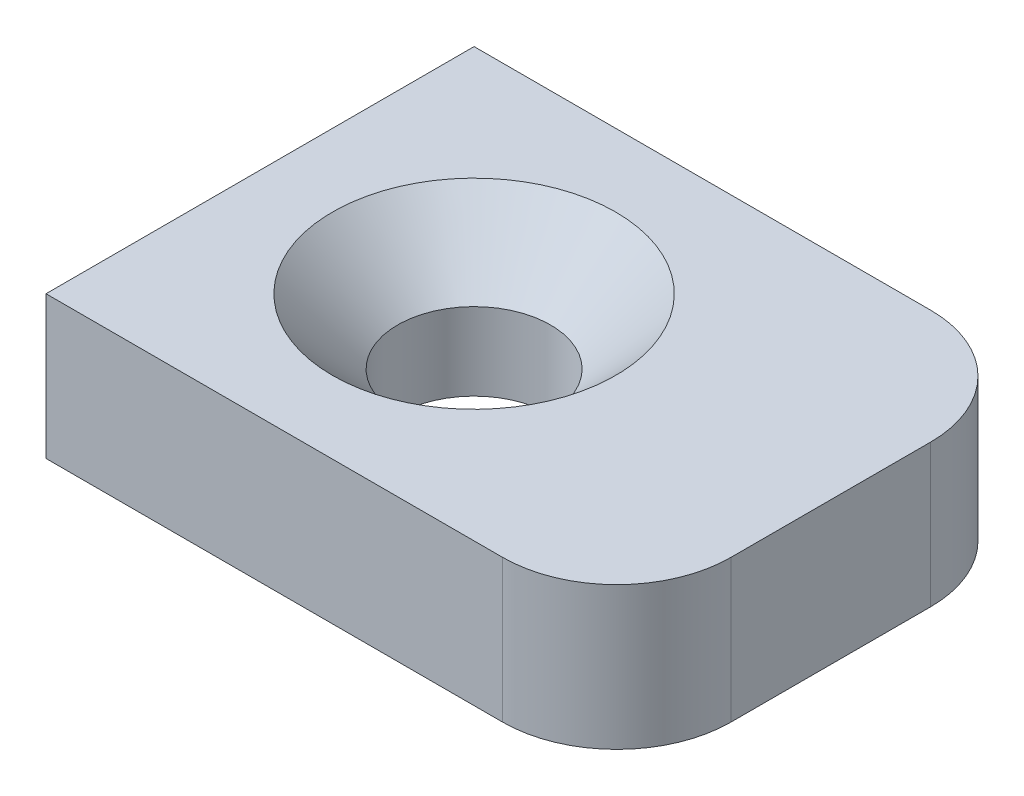
from build123d import *

# Parameters (mm, degrees)
SKETCH1_W                                       = 12.7
SKETCH1_H                                       = 9.525
BOSS_EXTRUDE1_DEPTH                             = 3.175
CSK_FOR_M3_FLAT_HEAD_MACHINE_SCREW1_D           = 3.4
CSK_FOR_M3_FLAT_HEAD_MACHINE_SCREW1_CSINK_D     = 6.3
CSK_FOR_M3_FLAT_HEAD_MACHINE_SCREW1_CSINK_ANGLE = 90
FILLET1_R                                       = 2.54


with BuildPart() as part:
    # Sketch1 → Boss-Extrude1 (new body)
    with BuildSketch(Plane(origin=(0, 0, 0), x_dir=(1, 0, 0), z_dir=(0, 1, 0))):
        Rectangle(SKETCH1_W, SKETCH1_H)
    extrude(amount=BOSS_EXTRUDE1_DEPTH)

    # CSK for M3 Flat Head Machine Screw1 (through all)
    with Locations(Plane(origin=(0, 3.175, 0), x_dir=(1, 0, 0), z_dir=(0, 1, 0))):
        with Locations((-1.5875, 0)):
            CounterSinkHole(CSK_FOR_M3_FLAT_HEAD_MACHINE_SCREW1_D / 2, CSK_FOR_M3_FLAT_HEAD_MACHINE_SCREW1_CSINK_D / 2, counter_sink_angle=CSK_FOR_M3_FLAT_HEAD_MACHINE_SCREW1_CSINK_ANGLE)

    # Fillet1
    fillet1_edges = [part.edges().sort_by_distance(p)[0] for p in [
        (6.35, 1.5875, -4.7625),
        (6.35, 1.5875, 4.7625),
    ]]
    fillet(fillet1_edges, radius=FILLET1_R)


solid = part.part
